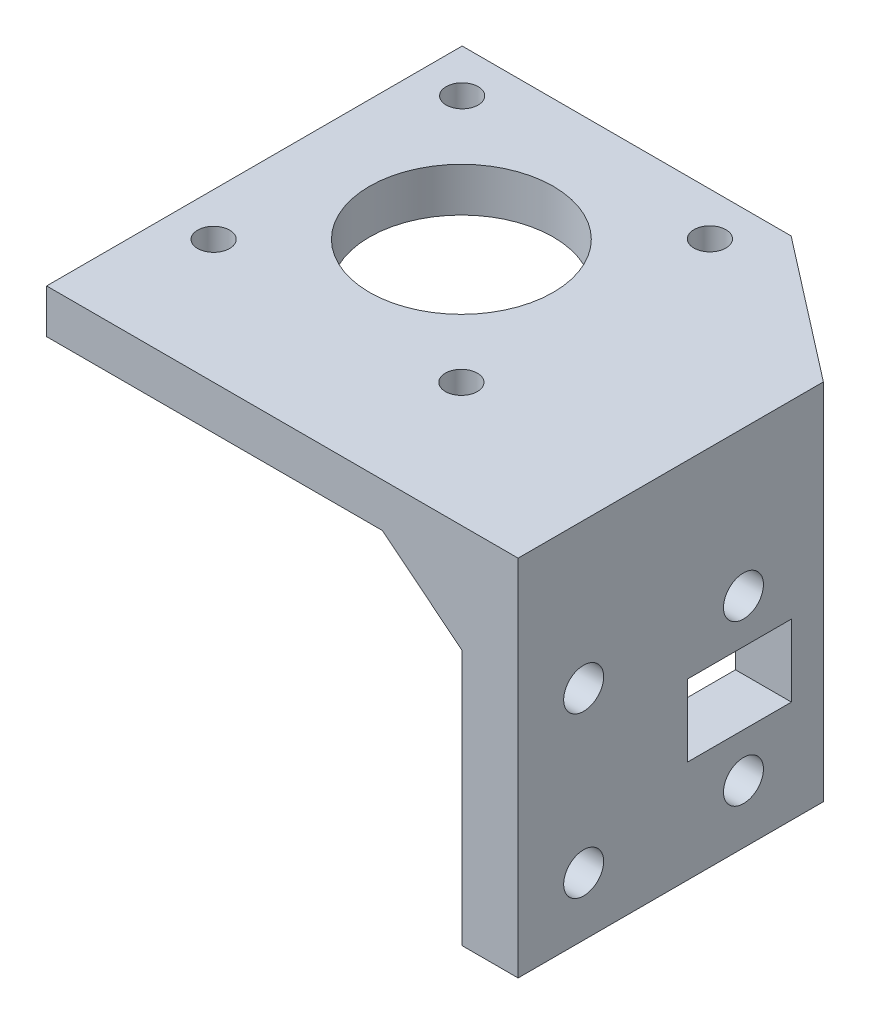
from build123d import *

# Parameters (mm, degrees)
SKETCH1_W           = 59
SKETCH1_H           = 52
BOSS_EXTRUDE1_DEPTH = 5.5
SKETCH2_R           = 2
CUT_EXTRUDE1_DEPTH  = 10
SKETCH4_W           = 7
SKETCH4_H           = 52
BOSS_EXTRUDE3_DEPTH = 40
SKETCH5_R           = 2.5
CUT_EXTRUDE2_DEPTH  = 33
SKETCH6_W           = 13.8
SKETCH6_H           = 40
CUT_EXTRUDE3_DEPTH  = 33
CUT_EXTRUDE4_DEPTH  = 33
BOSS_EXTRUDE6_DEPTH = 38.2
SKETCH10_W          = 13
SKETCH10_H          = 9
CUT_EXTRUDE8_DEPTH  = 10
SKETCH11_R          = 11.5
CUT_EXTRUDE9_DEPTH  = 10


with BuildPart() as part:
    # Sketch1 → Boss-Extrude1 (new body)
    with BuildSketch(Plane(origin=(0, 0, 0), x_dir=(1, 0, 0), z_dir=(0, 1, 0))):
        with Locations((-29.5, -26)):
            Rectangle(SKETCH1_W, SKETCH1_H)
    extrude(amount=BOSS_EXTRUDE1_DEPTH)

    # Sketch2 → Cut-Extrude1 (cut)
    with BuildSketch(Plane(origin=(0, 5.5, 0), x_dir=(1, 0, 0), z_dir=(0, 1, 0))):
        with Locations(Location((-53.6, -5.4, 0), (0, 0, 270))):
            Circle(SKETCH2_R)
        with Locations(Location((-22.6, -5.4, 0), (0, 0, 270))):
            Circle(SKETCH2_R)
        with Locations(Location((-53.6, -36.5, 0), (0, 0, 270))):
            Circle(SKETCH2_R)
        with Locations(Location((-22.6, -36.5, 0), (0, 0, 270))):
            Circle(SKETCH2_R)
    extrude(amount=-CUT_EXTRUDE1_DEPTH, mode=Mode.SUBTRACT)

    # Sketch4 → Boss-Extrude3 (add)
    with BuildSketch(Plane(origin=(0, 0, 0), x_dir=(-1, 0, 0), z_dir=(0, -1, 0))):
        with Locations((3.5, -26)):
            Rectangle(SKETCH4_W, SKETCH4_H)
    extrude(amount=BOSS_EXTRUDE3_DEPTH)

    # Sketch5 → Cut-Extrude2 (cut)
    with BuildSketch(Plane.ZY.offset(7)):
        with Locations((43.8, -32.7)):
            Circle(SKETCH5_R)
        with Locations((43.8, -12.7)):
            Circle(SKETCH5_R)
        with Locations((23.8, -32.7)):
            Circle(SKETCH5_R)
        with Locations((23.8, -12.7)):
            Circle(SKETCH5_R)
    extrude(amount=-CUT_EXTRUDE2_DEPTH, mode=Mode.SUBTRACT)

    # Sketch6 → Cut-Extrude3 (cut)
    with BuildSketch(Plane.ZY.offset(7)):
        with Locations((6.9, -20)):
            Rectangle(SKETCH6_W, SKETCH6_H)
    extrude(amount=-CUT_EXTRUDE3_DEPTH, mode=Mode.SUBTRACT)

    # Sketch7 → Cut-Extrude4 (cut)
    with BuildSketch(Plane(origin=(0, 0, 0), x_dir=(-1, 0, 0), z_dir=(0, -1, 0))):
        Polygon((0, 0), (0, -13.8), (17.836375114, 0), align=None)
    extrude(amount=-CUT_EXTRUDE4_DEPTH, mode=Mode.SUBTRACT)

    # Sketch8 → Boss-Extrude6 (add)
    with BuildSketch(Plane.XY.offset(52)):
        Polygon((-7, 0), (-7, -8), (-17, 0), align=None)
    extrude(amount=-BOSS_EXTRUDE6_DEPTH)

    # Sketch10 → Cut-Extrude8 (cut)
    with BuildSketch(Plane.ZY.offset(7)):
        with Locations((24.3, -22.7)):
            Rectangle(SKETCH10_W, SKETCH10_H)
    extrude(amount=-CUT_EXTRUDE8_DEPTH, mode=Mode.SUBTRACT)

    # Sketch11 → Cut-Extrude9 (cut)
    with BuildSketch(Plane(origin=(0, 5.5, 0), x_dir=(1, 0, 0), z_dir=(0, 1, 0))):
        with Locations(Location((-38.1, -21, 0), (0, 0, 270))):
            Circle(SKETCH11_R)
    extrude(amount=-CUT_EXTRUDE9_DEPTH, mode=Mode.SUBTRACT)


solid = part.part
